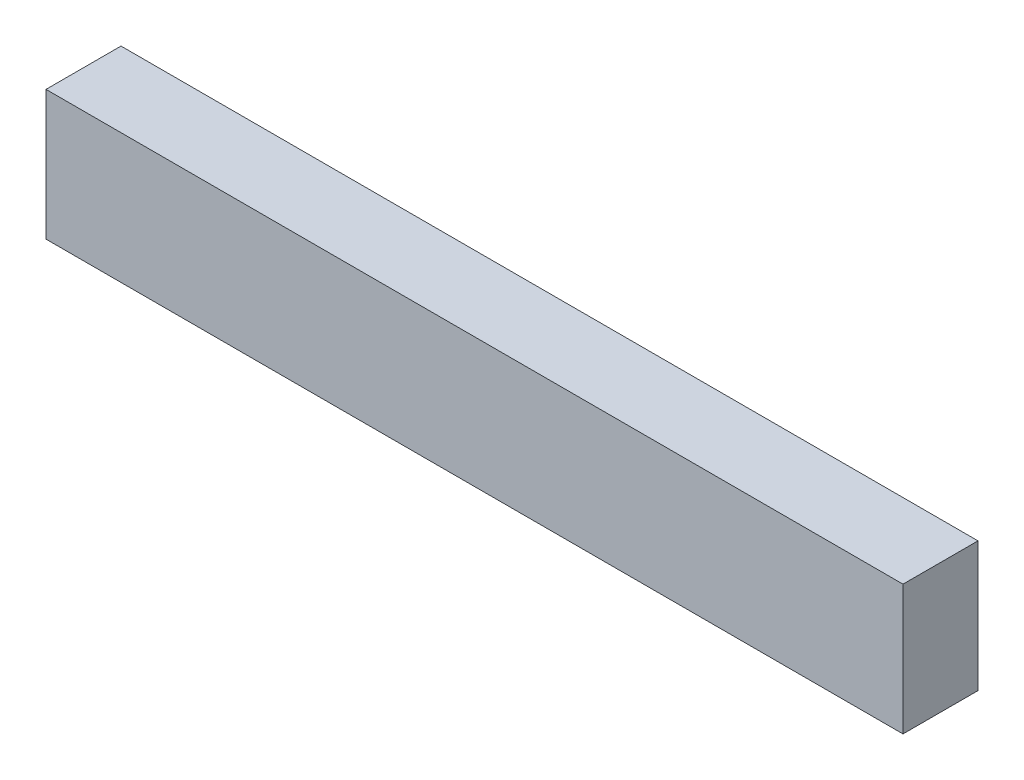
from build123d import *

# Parameters (mm, degrees)
SKETCH1_W                 = 82.84
SKETCH1_H                 = 12.54
BOSS_EXTRUDE1_DEPTH       = 7.25
SHELL1_T                  = -0.5
SHELL1_THICKNESS_2_FACE_W = 81.84
SHELL1_THICKNESS_2_FACE_H = 11.54
SHELL1_THICKNESS_2_DEPTH  = 0.3


with BuildPart() as part:
    # Sketch1 → Boss-Extrude1 (new body)
    with BuildSketch(Plane.XY):
        with Locations((24.6445, 39.86)):
            Rectangle(SKETCH1_W, SKETCH1_H)
    extrude(amount=BOSS_EXTRUDE1_DEPTH)

    # Shell1
    shell1_openings = [part.faces().sort_by_distance(p)[0] for p in [
        (24.6445, 39.86, 0),
    ]]
    offset(amount=SHELL1_T, openings=shell1_openings, kind=Kind.INTERSECTION)

    # Shell1 thickness 2 face (on inner face of the shell) → Shell1 thickness 2 (cut)
    with BuildSketch(Plane(origin=(24.6445, 39.86, 6.75), x_dir=(1, 0, 0), z_dir=(0, 0, 1))):
        Rectangle(SHELL1_THICKNESS_2_FACE_W, SHELL1_THICKNESS_2_FACE_H)
    extrude(amount=SHELL1_THICKNESS_2_DEPTH, mode=Mode.SUBTRACT)


solid = part.part
